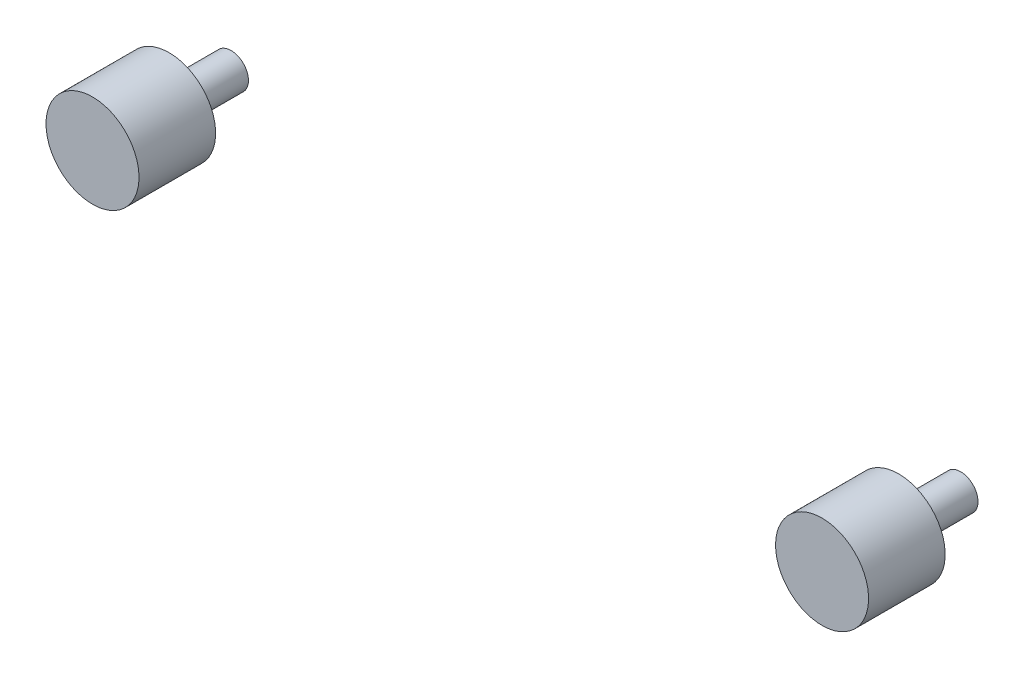
from build123d import *

# Parameters (mm, degrees)
SKETCH_5_R                          = 12.75
V09_C_LIGHT_HEADS_D25P5_L21_DEPTH   = 21
V09_C_LIGHT_HEADS_D25P5_L21_2_DEPTH = 21
V09_C_LIGHT_STUDS_D9P5_L17_START    = -17
SKETCH_6_R                          = 4.75
V09_C_LIGHT_STUDS_D9P5_L17_DEPTH    = 17


with BuildPart() as part:
    # 草图5 → V09_C_light_heads_D25p5_L21 (new body)
    with BuildSketch(Plane.XY):
        with Locations(Location((-100, 60, 0), (0, 0, 180))):
            Circle(SKETCH_5_R)
    extrude(amount=V09_C_LIGHT_HEADS_D25P5_L21_DEPTH)



with BuildPart() as body_2:
    # 草图5 → V09_C_light_heads_D25p5_L21 2 (new body)
    with BuildSketch(Plane.XY):
        with Locations(Location((100, 60, 0), (0, 0, 180))):
            Circle(SKETCH_5_R)
    extrude(amount=V09_C_LIGHT_HEADS_D25P5_L21_2_DEPTH)


with BuildPart() as part_1:
    add(part.part)

    add(body_2.part)  # V09_C_light_studs_D9p5_L17 merges body 2
    # 草图6 → V09_C_light_studs_D9p5_L17 (add)
    with BuildSketch(Plane.XY.offset(V09_C_LIGHT_STUDS_D9P5_L17_START)):
        with Locations((-100, 60)):
            Circle(SKETCH_6_R)
        with Locations((100, 60)):
            Circle(SKETCH_6_R)
    extrude(amount=V09_C_LIGHT_STUDS_D9P5_L17_DEPTH)


solid = part_1.part
